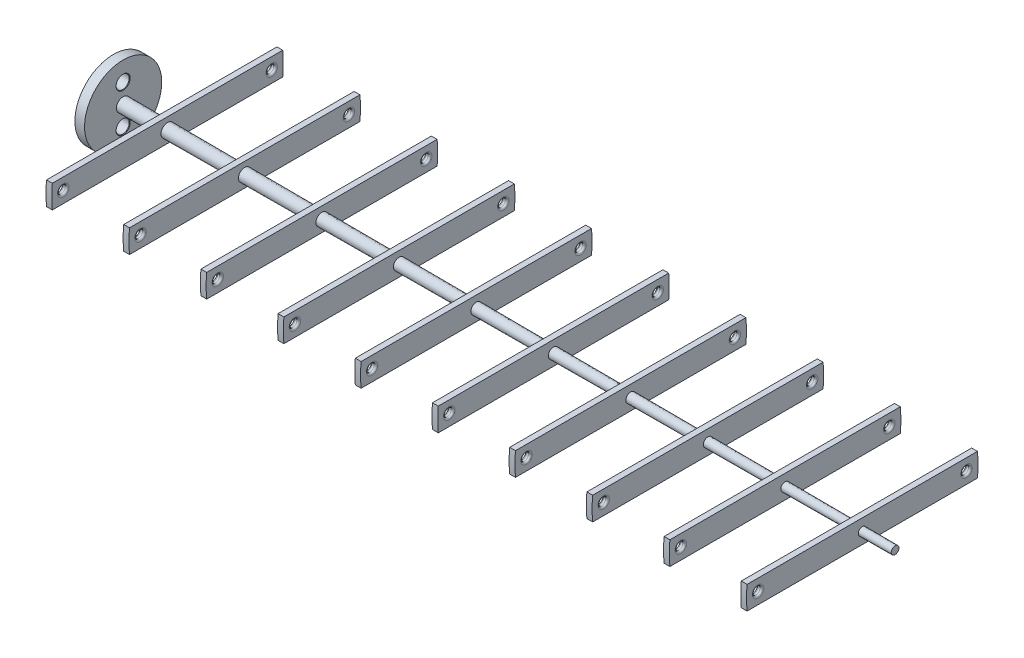
from build123d import *

# Parameters (mm, degrees)
SKETCH3_W                      = 1.5
SKETCH3_H                      = 30
CUT_EXTRUDE1_REACH             = 195.216
SKETCH5_R                      = 1
FILLET1_R                      = 0.5
CUT_EXTRUDE2_DEPTH             = 194.215553204
LPATTERN1_COUNT                = 10
LPATTERN1_PITCH                = 20
FILLET1_OF_LPATTERN1_R         = 0.5
SKETCH16_R                     = 10
BOSS_EXTRUDE1_DEPTH            = 2.5
M3_CLEARANCE_HOLE2_D           = 3.4
M3_CLEARANCE_HOLE2_CSINK_D     = 3.65
M3_CLEARANCE_HOLE2_CSINK_ANGLE = 90


with BuildPart() as part:
    # Sketch2 → Revolve1 (revolve)
    with BuildSketch(Plane.XY):
        Polygon((0, 1.75), (200, 1), (200, 0), (0, 0), align=None)
    revolve(axis=Axis((200, 0, 0), (-1, 0, 0)))

    # Sketch3 → Revolve2 (revolve)
    with BuildSketch(Plane.XY):
        with Locations((10.75, 15)):
            Rectangle(SKETCH3_W, SKETCH3_H)
    revolve2 = revolve(axis=Axis((11.5, 0, 0), (-1, 0, 0)))

    # Sketch5 → Cut-Extrude1 (cut, up to next)
    with BuildSketch(Plane(origin=(11.5, 0, 0), x_dir=(0, 0, -1), z_dir=(1, 0, 0)), mode=Mode.PRIVATE) as cut_extrude1_sk1:
        with Locations(Location((-27, 0, 0), (0, 0, 90))):
            Circle(SKETCH5_R)
    cut_extrude1_tool1 = extrude(cut_extrude1_sk1.sketch, amount=-CUT_EXTRUDE1_REACH, mode=Mode.PRIVATE) & part.part
    # Sketch5 → Cut-Extrude1 (cut, up to next)
    with BuildSketch(Plane(origin=(11.5, 0, 0), x_dir=(0, 0, -1), z_dir=(1, 0, 0)), mode=Mode.PRIVATE) as cut_extrude1_sk2:
        with Locations(Location((27, 0, 0), (0, 0, 90))):
            Circle(SKETCH5_R)
    cut_extrude1_tool2 = extrude(cut_extrude1_sk2.sketch, amount=-CUT_EXTRUDE1_REACH, mode=Mode.PRIVATE) & part.part
    cut_extrude1_1 = cut_extrude1_tool1.solids().sort_by_distance((11.5, 0, 27))[0]
    add(cut_extrude1_1, mode=Mode.SUBTRACT)
    cut_extrude1_2 = cut_extrude1_tool2.solids().sort_by_distance((11.5, 0, -27))[0]
    add(cut_extrude1_2, mode=Mode.SUBTRACT)
    cut_extrude1 = cut_extrude1_1 + cut_extrude1_2  # Cut-Extrude1 as one shape, for the pattern or mirror that repeats it

    # Fillet1
    fillet1_edges = [part.edges().sort_by_distance(p)[0] for p in [
        (10, -1, 27),
        (11.5, -1, 27),
        (10, -1, -27),
        (11.5, -1, -27),
    ]]
    fillet(fillet1_edges, radius=FILLET1_R)

    # Sketch24 → Cut-Extrude2 (cut, symmetric)
    with BuildSketch(Plane(origin=(11.5, 0, 0), x_dir=(0, 0, -1), z_dir=(1, 0, 0))):
        with BuildLine():
            ThreePointArc((29.849230662, 3.003902276), (0, 30), (-29.849230662, 3.003902276))
            Line((-29.849230662, 3.003902276), (29.849230662, 3.003902276))
        make_face()
        with BuildLine():
            Line((29.849623113, -3), (-29.849623113, -3))
            ThreePointArc((-29.849623113, -3), (0, -30), (29.849623113, -3))
        make_face()
    cut_extrude2 = extrude(amount=CUT_EXTRUDE2_DEPTH, both=True, mode=Mode.SUBTRACT)

    # LPattern1: Revolve2, Cut-Extrude1, Cut-Extrude2 ×10
    with Locations(*[(i * LPATTERN1_PITCH, 0, 0) for i in range(1, LPATTERN1_COUNT)]):
        add(revolve2)
        add(cut_extrude1, mode=Mode.SUBTRACT)
        add(cut_extrude2, mode=Mode.SUBTRACT)

    # Fillet1 of LPattern1
    fillet1_of_lpattern1_edges = [part.edges().sort_by_distance(p)[0] for p in [
        (30, -1, 27),
        (31.5, -1, 27),
        (30, -1, -27),
        (31.5, -1, -27),
        (50, -1, 27),
        (51.5, -1, 27),
        (50, -1, -27),
        (51.5, -1, -27),
        (70, -1, 27),
        (71.5, -1, 27),
        (70, -1, -27),
        (71.5, -1, -27),
        (90, -1, 27),
        (91.5, -1, 27),
        (90, -1, -27),
        (91.5, -1, -27),
        (110, -1, 27),
        (111.5, -1, 27),
        (110, -1, -27),
        (111.5, -1, -27),
        (130, -1, 27),
        (131.5, -1, 27),
        (130, -1, -27),
        (131.5, -1, -27),
        (150, -1, 27),
        (151.5, -1, 27),
        (150, -1, -27),
        (151.5, -1, -27),
        (170, -1, 27),
        (171.5, -1, 27),
        (170, -1, -27),
        (171.5, -1, -27),
        (190, -1, 27),
        (191.5, -1, 27),
        (190, -1, -27),
        (191.5, -1, -27),
    ]]
    fillet(fillet1_of_lpattern1_edges, radius=FILLET1_OF_LPATTERN1_R)

    # Sketch16 → Boss-Extrude1 (add)
    with BuildSketch(Plane.ZY):
        with Locations(Location((0, 0, 0), (0, 0, 270))):
            Circle(SKETCH16_R)
    extrude(amount=BOSS_EXTRUDE1_DEPTH)

    # M3 Clearance Hole2 (through all)
    with Locations(Plane(origin=(0, 0, 0), x_dir=(0, 0, -1), z_dir=(1, 0, 0))):
        with Locations((0, 5), (0, -5)):
            CounterSinkHole(M3_CLEARANCE_HOLE2_D / 2, M3_CLEARANCE_HOLE2_CSINK_D / 2, counter_sink_angle=M3_CLEARANCE_HOLE2_CSINK_ANGLE)


solid = part.part
